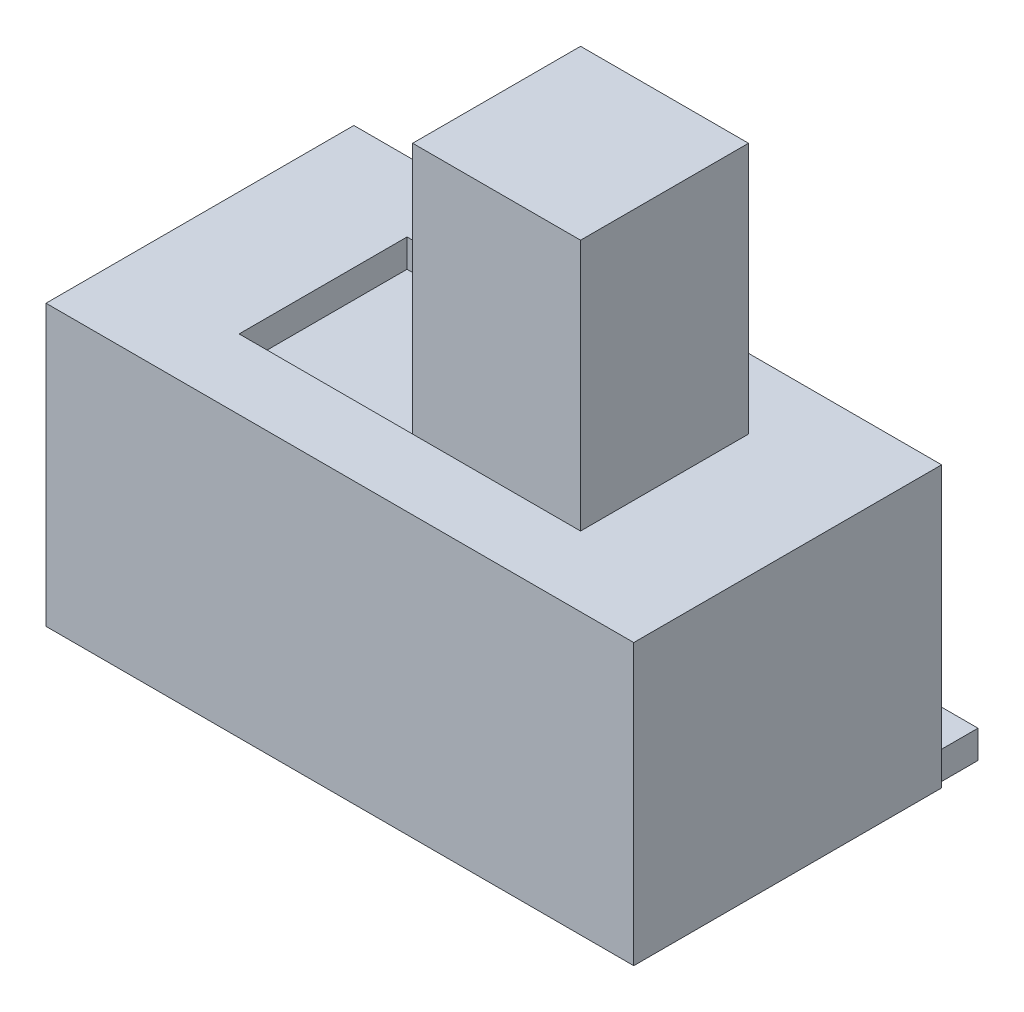
from build123d import *

# Parameters (mm, degrees)
SKETCH1_W           = 10.5
SKETCH1_H           = 5
BOSS_EXTRUDE1_DEPTH = 5.5
SKETCH2_W           = 6.1
SKETCH2_H           = 3
CUT_EXTRUDE1_DEPTH  = 0.5
SKETCH3_W           = 3
SKETCH3_H           = 3
BOSS_EXTRUDE2_DEPTH = 5
BOSS_EXTRUDE3_DEPTH = 0.4
LPATTERN1_COUNT     = 2
LPATTERN1_PITCH     = 3
LPATTERN1_COL_COUNT = 2
LPATTERN1_COL_PITCH = 3


with BuildPart() as part:
    # Sketch1 → Boss-Extrude1 (new body)
    with BuildSketch(Plane.XY):
        with Locations((0, 2.5)):
            Rectangle(SKETCH1_W, SKETCH1_H)
    extrude(amount=BOSS_EXTRUDE1_DEPTH)

    # Sketch2 → Cut-Extrude1 (cut)
    with BuildSketch(Plane(origin=(0, 5, 0), x_dir=(1, 0, 0), z_dir=(0, 1, 0))):
        with Locations((0, -2.75)):
            Rectangle(SKETCH2_W, SKETCH2_H)
    extrude(amount=-CUT_EXTRUDE1_DEPTH, mode=Mode.SUBTRACT)

    # Sketch3 → Boss-Extrude2 (add)
    with BuildSketch(Plane(origin=(0, 4.5, 0), x_dir=(1, 0, 0), z_dir=(0, 1, 0))):
        with Locations((1.55, -2.75)):
            Rectangle(SKETCH3_W, SKETCH3_H)
    extrude(amount=BOSS_EXTRUDE2_DEPTH)

    # Sketch4 → Boss-Extrude3 (add, symmetric)
    with BuildSketch(Plane(origin=(0, 0, 0), x_dir=(0, 0, -1), z_dir=(1, 0, 0))):
        with BuildLine():
            Line((-2.5, 0), (-2.5, -0.65))
            ThreePointArc((-2.5, -0.65), (-2.324264069, -1.074264069), (-1.9, -1.25))
            Line((-1.9, -1.25), (2.5, -1.25))
            Line((2.5, -1.25), (2.5, -1.75))
            Line((2.5, -1.75), (-1.9, -1.75))
            ThreePointArc((-1.9, -1.75), (-2.677817459, -1.427817459), (-3, -0.65))
            Line((-3, -0.65), (-3, 0))
            Line((-3, 0), (-2.5, 0))
        make_face()
    boss_extrude3 = extrude(amount=BOSS_EXTRUDE3_DEPTH, both=True)

    # LPattern1: Boss-Extrude3 ×2
    with Locations(*[(-i * LPATTERN1_PITCH, 0, 0) for i in range(1, LPATTERN1_COUNT)]):
        add(boss_extrude3)

    # LPattern1 col: Boss-Extrude3 ×2
    with Locations(*[(i * LPATTERN1_COL_PITCH, 0, 0) for i in range(1, LPATTERN1_COL_COUNT)]):
        add(boss_extrude3)


solid = part.part
